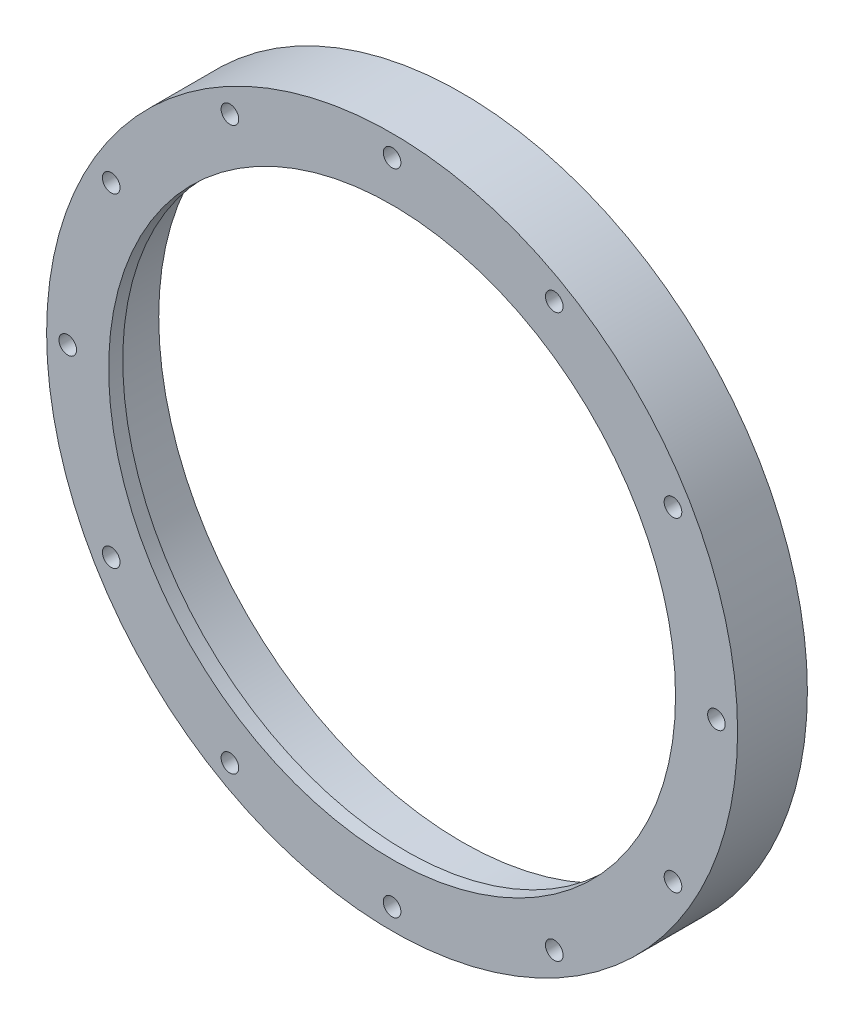
from build123d import *

# Parameters (mm, degrees)
SKETCH_1_R               = 49
SKETCH_1_R_2             = 43
EXTRUDE_1_DEPTH          = 7.9
SKETCH_3_R               = 49
SKETCH_3_R_2             = 40.2
EXTRUDE_3_DEPTH          = 2
HOLE_WIZARD_M3_1_D       = 2.5
PATTERN_CIRCULAR_1_COUNT = 12


with BuildPart() as part:
    # 草图1 → 凸台-拉伸1 (new body)
    with BuildSketch(Plane.XY):
        Circle(SKETCH_1_R)
        Circle(SKETCH_1_R_2, mode=Mode.SUBTRACT)
    extrude(amount=EXTRUDE_1_DEPTH)

    # 草图3 → 凸台-拉伸3 (add)
    with BuildSketch(Plane.XY.offset(7.9)):
        Circle(SKETCH_3_R)
        Circle(SKETCH_3_R_2, mode=Mode.SUBTRACT)
    extrude(amount=EXTRUDE_3_DEPTH)

    # M3 螺纹孔1 (through all)
    with Locations(Plane(origin=(0, 0, 0), x_dir=(-1, 0, 0), z_dir=(0, 0, -1))):
        with Locations((0, 46)):
            hole_wizard_m3_1 = Hole(HOLE_WIZARD_M3_1_D / 2)

    # 阵列(圆周)1: M3 螺纹孔1 ×12 about axis
    pattern_circular_1_axis = Axis((0, 0, 0), (0, 0, 1))
    for i in range(1, PATTERN_CIRCULAR_1_COUNT):
        add(hole_wizard_m3_1.rotate(pattern_circular_1_axis, i * 360 / PATTERN_CIRCULAR_1_COUNT), mode=Mode.SUBTRACT)


solid = part.part
